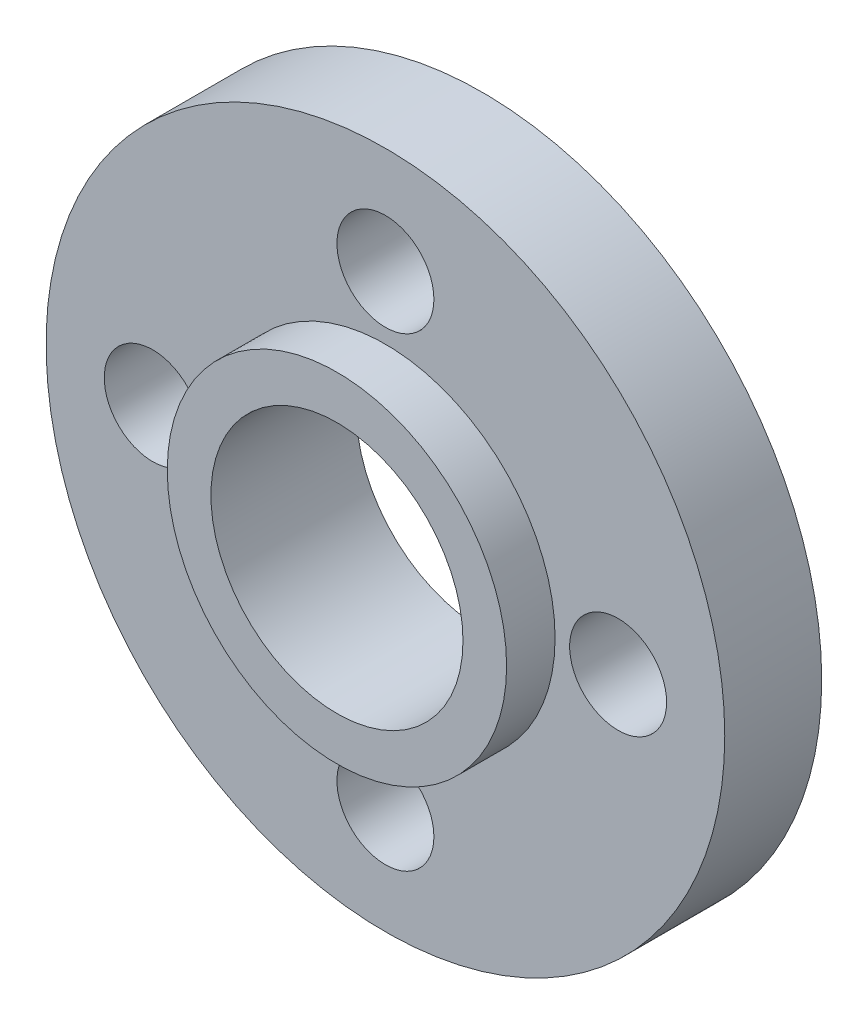
from build123d import *

# Parameters (mm, degrees)
SKETCH_2_R      = 7
SKETCH_2_R_2    = 2.6
SKETCH_2_R_3    = 1
EXTRUDE_1_DEPTH = 2
SKETCH_3_R      = 3.5
SKETCH_3_R_2    = 2.6
EXTRUDE_2_DEPTH = 1


with BuildPart() as part:
    # Эскиз2 → Бобышка-Вытянуть1 (new body)
    with BuildSketch(Plane.XY):
        Circle(SKETCH_2_R)
        Circle(SKETCH_2_R_2, mode=Mode.SUBTRACT)
        with Locations((-4.8, 0)):
            Circle(SKETCH_2_R_3, mode=Mode.SUBTRACT)
        with Locations((0, 4.8)):
            Circle(SKETCH_2_R_3, mode=Mode.SUBTRACT)
        with Locations((4.8, 0)):
            Circle(SKETCH_2_R_3, mode=Mode.SUBTRACT)
        with Locations((0, -4.8)):
            Circle(SKETCH_2_R_3, mode=Mode.SUBTRACT)
    extrude(amount=EXTRUDE_1_DEPTH)

    # Эскиз3 → Бобышка-Вытянуть2 (add)
    with BuildSketch(Plane.XY.offset(2)):
        Circle(SKETCH_3_R)
        Circle(SKETCH_3_R_2, mode=Mode.SUBTRACT)
    extrude(amount=EXTRUDE_2_DEPTH)


solid = part.part
